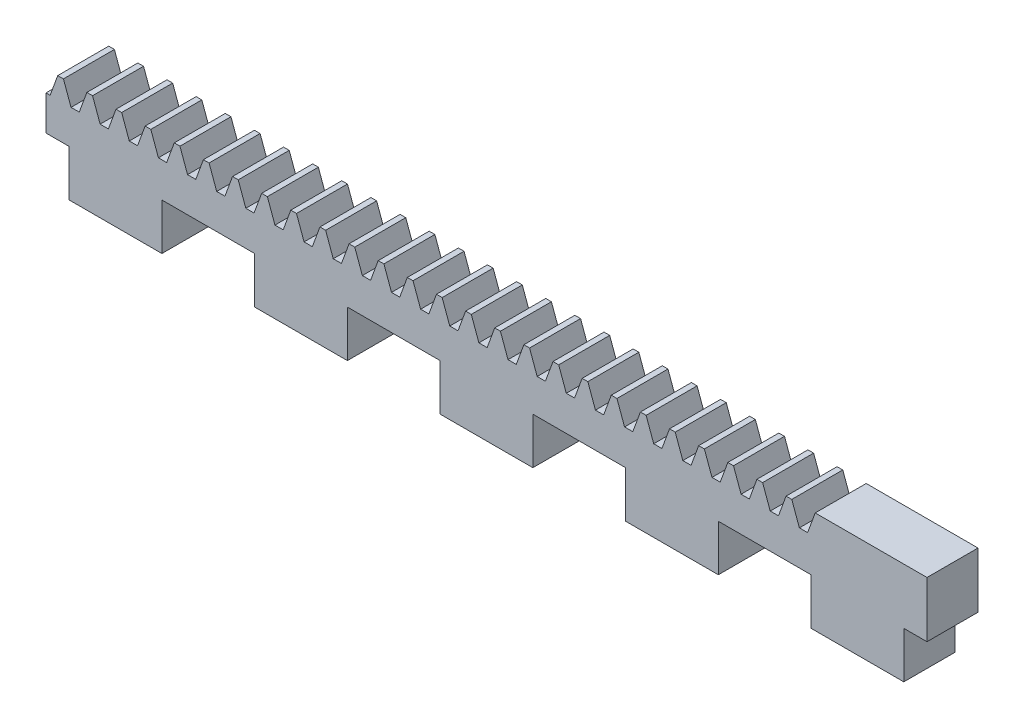
from build123d import *

# Parameters (mm, degrees)
BLANKSKE_W          = 95
BLANKSKE_H          = 11
BLANK_DEPTH         = 5.5
TOOTHCUTSIM_DEPTH   = 96.792745028
TEETHCUTS_COUNT     = 27
TEETHCUTS_PITCH     = 3.14159265
SKETCH_1_W          = 10
SKETCH_1_H          = 5
CUT_EXTRUDE_1_DEPTH = 96.792745028


with BuildPart() as part:
    # BlankSke → Blank (new body)
    with BuildSketch(Plane.XY):
        with Locations((47.5, 5.5)):
            Rectangle(BLANKSKE_W, BLANKSKE_H)
    extrude(amount=-BLANK_DEPTH)

    # TooCutSkeSim → ToothCutSim (cut, through all)
    with BuildSketch(Plane.XY):
        Polygon((0.44443537, 8.75), (-0.44443537, 8.75), (-1.272613241, 11.0254), (1.272613241, 11.0254), align=None)
    toothcutsim = extrude(amount=-TOOTHCUTSIM_DEPTH, mode=Mode.SUBTRACT)

    # TeethCuts: ToothCutSim ×27
    with Locations(*[(i * TEETHCUTS_PITCH, 0, 0) for i in range(1, TEETHCUTS_COUNT)]):
        add(toothcutsim, mode=Mode.SUBTRACT)

    # ｽｹｯﾁ1 → ｶｯﾄ - 押し出し1 (cut, through all)
    with BuildSketch(Plane(origin=(0, 0, -5.5), x_dir=(-1, 0, 0), z_dir=(0, 0, -1))):
        with Locations((-97.5, 2.5)):
            Rectangle(SKETCH_1_W, SKETCH_1_H)
        with Locations((2.5, 2.5)):
            Rectangle(SKETCH_1_W, SKETCH_1_H)
        with Locations((-17.5, 2.5)):
            Rectangle(SKETCH_1_W, SKETCH_1_H)
        with Locations((-37.5, 2.5)):
            Rectangle(SKETCH_1_W, SKETCH_1_H)
        with Locations((-57.5, 2.5)):
            Rectangle(SKETCH_1_W, SKETCH_1_H)
        with Locations((-77.5, 2.5)):
            Rectangle(SKETCH_1_W, SKETCH_1_H)
    extrude(amount=-CUT_EXTRUDE_1_DEPTH, mode=Mode.SUBTRACT)


solid = part.part
